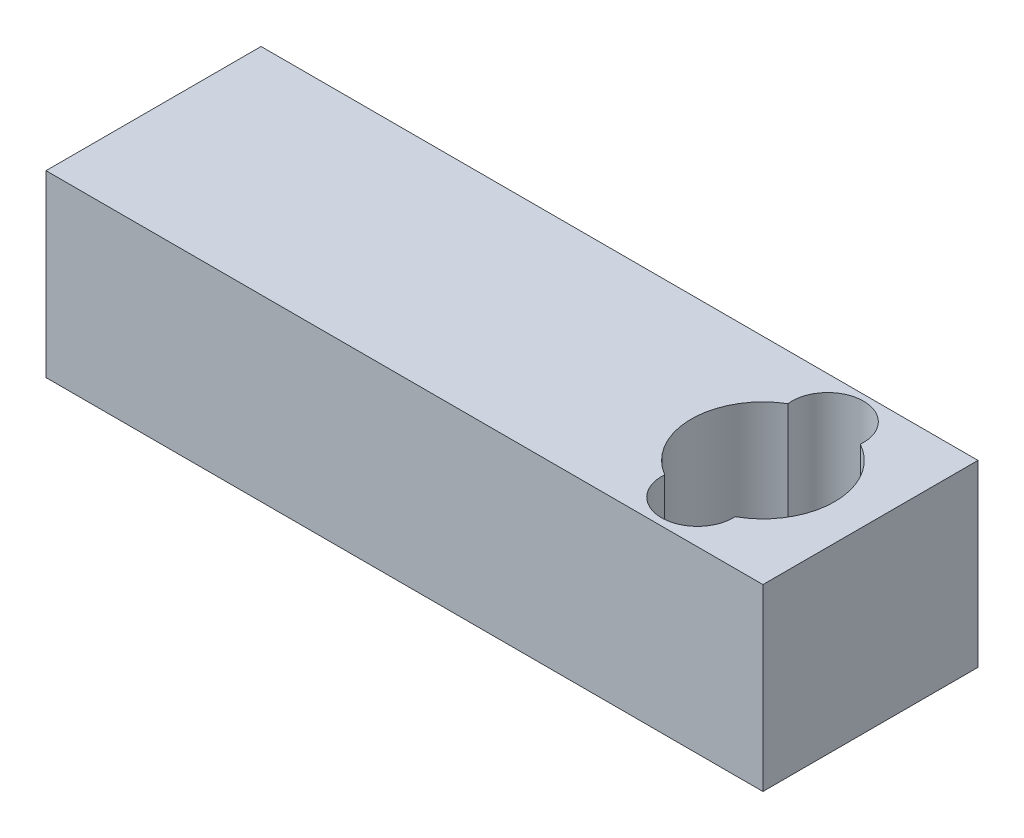
from build123d import *

# Parameters (mm, degrees)
SKETCH_1_W      = 100
SKETCH_1_H      = 30
EXTRUDE_3_DEPTH = 25


with BuildPart() as part:
    # 草图1 → 凸台-拉伸3 (new body)
    with BuildSketch(Plane(origin=(0, 0, 0), x_dir=(1, 0, 0), z_dir=(0, 1, 0))):
        Rectangle(SKETCH_1_W, SKETCH_1_H)
        with BuildLine():
            ThreePointArc((39.834535229, 8.75370031), (43.612356016, 5.082059017), (45, 0))
            ThreePointArc((45, 0), (43.620805853, -5.067712151), (39.863658712, -8.737552514))
            ThreePointArc((39.863658712, -8.737552514), (34.79927033, -14.006397834), (29.887949458, -8.594587789))
            ThreePointArc((29.887949458, -8.594587789), (25, 0), (29.887949458, 8.594587789))
            ThreePointArc((29.887949458, 8.594587789), (34.773112936, 14.183369273), (39.834535229, 8.75370031))
        make_face(mode=Mode.SUBTRACT)
    extrude(amount=EXTRUDE_3_DEPTH)


solid = part.part
